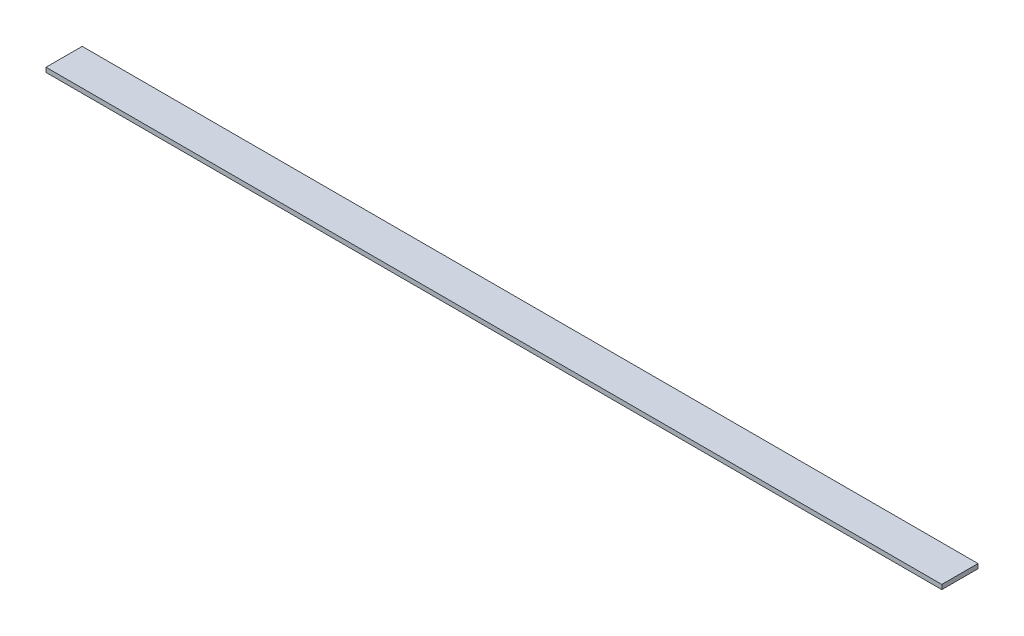
from build123d import *

# Parameters (mm, degrees)
SKETCH1_W           = 1257.3
SKETCH1_H           = 50.8
BOSS_EXTRUDE1_DEPTH = 6.35


with BuildPart() as part:
    # Sketch1 → Boss-Extrude1 (new body)
    with BuildSketch(Plane(origin=(0, 0, 0), x_dir=(1, 0, 0), z_dir=(0, 1, 0))):
        Rectangle(SKETCH1_W, SKETCH1_H)
    extrude(amount=BOSS_EXTRUDE1_DEPTH)


solid = part.part
